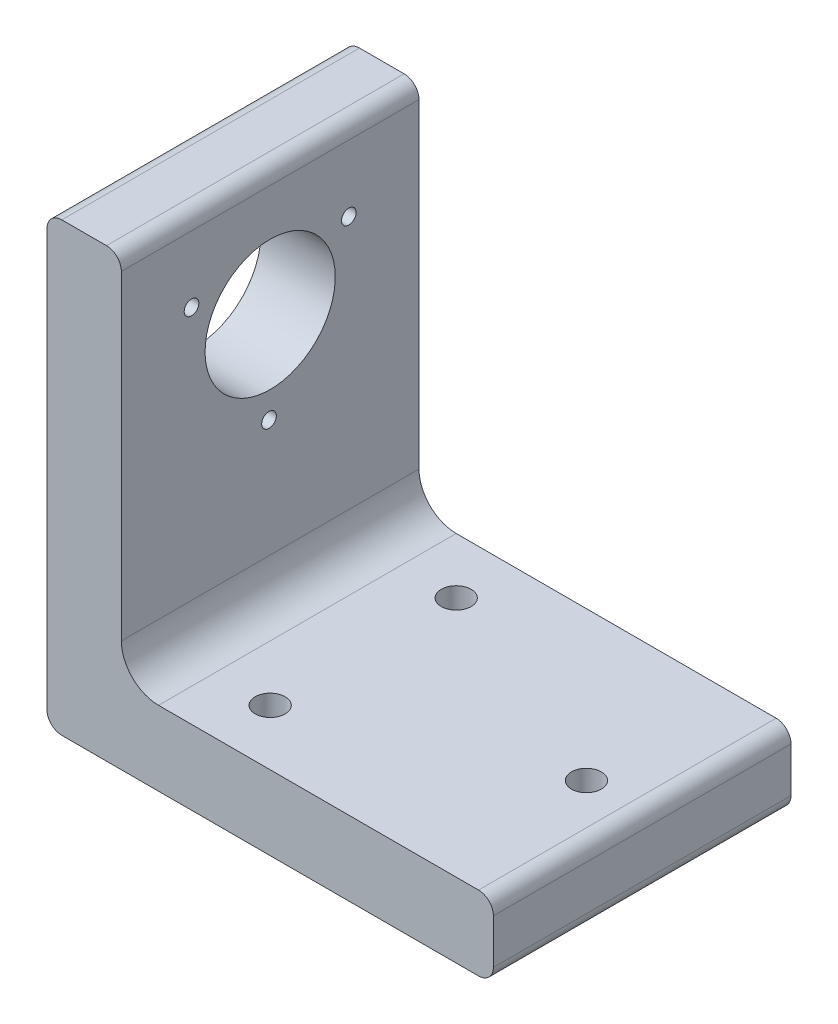
from build123d import *

# Parameters (mm, degrees)
BOSS_EXTRUDE1_DEPTH     = 50.8
FILLET1_R               = 2.54
FILLET2_R               = 6.35
SKETCH2_R               = 11.1125
CUT_EXTRUDE1_DEPTH      = 112.44204772
M3X0_5_TAPPED_HOLE1_D   = 2.5
F_1_4_20_TAPPED_HOLE1_D = 5.1054


with BuildPart() as part:
    # Sketch1 → Boss-Extrude1 (new body)
    with BuildSketch(Plane.XY):
        Polygon((0, 0), (0, 76.2), (12.7, 76.2), (12.7, 12.7), (76.2, 12.7), (76.2, 0), align=None)
    extrude(amount=BOSS_EXTRUDE1_DEPTH)

    # Fillet1
    fillet1_edges = [part.edges().sort_by_distance(p)[0] for p in [
        (0, 0, 25.4),
        (0, 76.2, 25.4),
        (12.7, 76.2, 25.4),
        (76.2, 12.7, 25.4),
        (76.2, 0, 25.4),
    ]]
    fillet(fillet1_edges, radius=FILLET1_R)

    # Fillet2
    fillet2_edges = [part.edges().sort_by_distance(p)[0] for p in [
        (12.7, 12.7, 25.4),
    ]]
    fillet(fillet2_edges, radius=FILLET2_R)

    # Sketch2 → Cut-Extrude1 (cut, through all)
    with BuildSketch(Plane(origin=(12.7, 0, 0), x_dir=(0, 0, -1), z_dir=(1, 0, 0))):
        with Locations(Location((-25.4, 54.61, 0), (0, 0, 90))):
            Circle(SKETCH2_R)
    extrude(amount=-CUT_EXTRUDE1_DEPTH, mode=Mode.SUBTRACT)

    # M3x0.5 Tapped Hole1 (through all)
    with Locations(Plane(origin=(12.7, 0, 0), x_dir=(0, 0, -1), z_dir=(1, 0, 0))):
        with Locations((-38.823393759, 62.36), (-11.976606241, 62.36), (-25.601459668, 39.111309281)):
            Hole(M3X0_5_TAPPED_HOLE1_D / 2)

    # 1/4-20 Tapped Hole1 (through all)
    with Locations(Plane(origin=(0, 12.7, 0), x_dir=(1, 0, 0), z_dir=(0, 1, 0))):
        with Locations((28.575, -9.525), (28.575, -41.275), (66.675, -25.4)):
            Hole(F_1_4_20_TAPPED_HOLE1_D / 2)


solid = part.part
